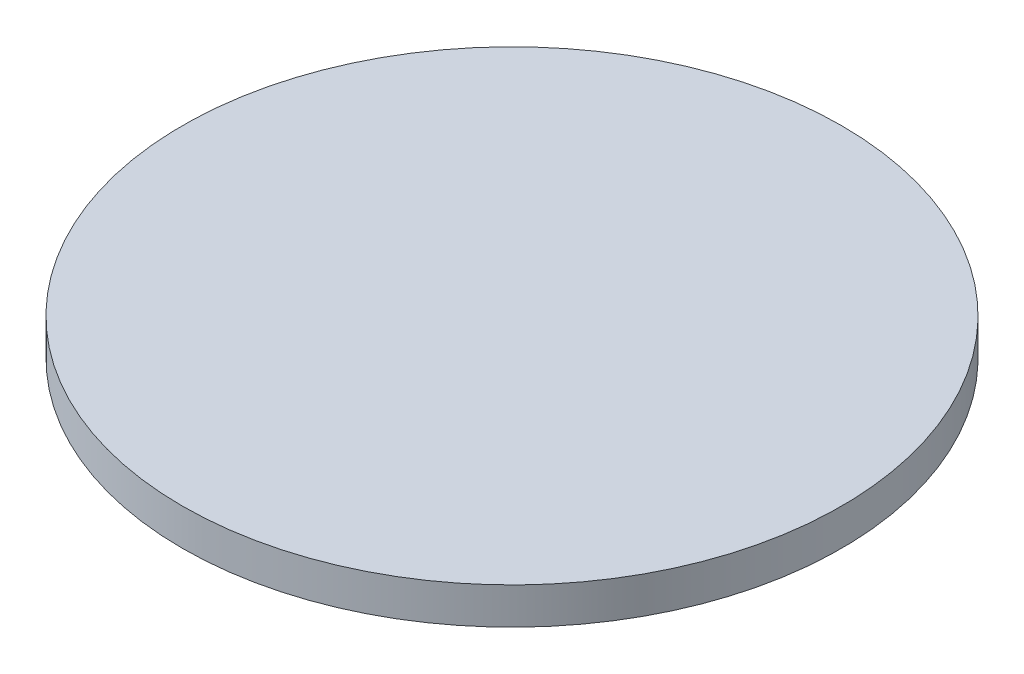
from build123d import *

# Parameters (mm, degrees)
SKETCH1_R           = 114.3
BOSS_EXTRUDE1_DEPTH = 12.7


with BuildPart() as part:
    # Sketch1 → Boss-Extrude1 (new body)
    with BuildSketch(Plane(origin=(0, 0, 0), x_dir=(1, 0, 0), z_dir=(0, 1, 0))):
        with Locations(Location((0, 0, 0), (0, 0, 90))):
            Circle(SKETCH1_R)
    extrude(amount=BOSS_EXTRUDE1_DEPTH)


solid = part.part
